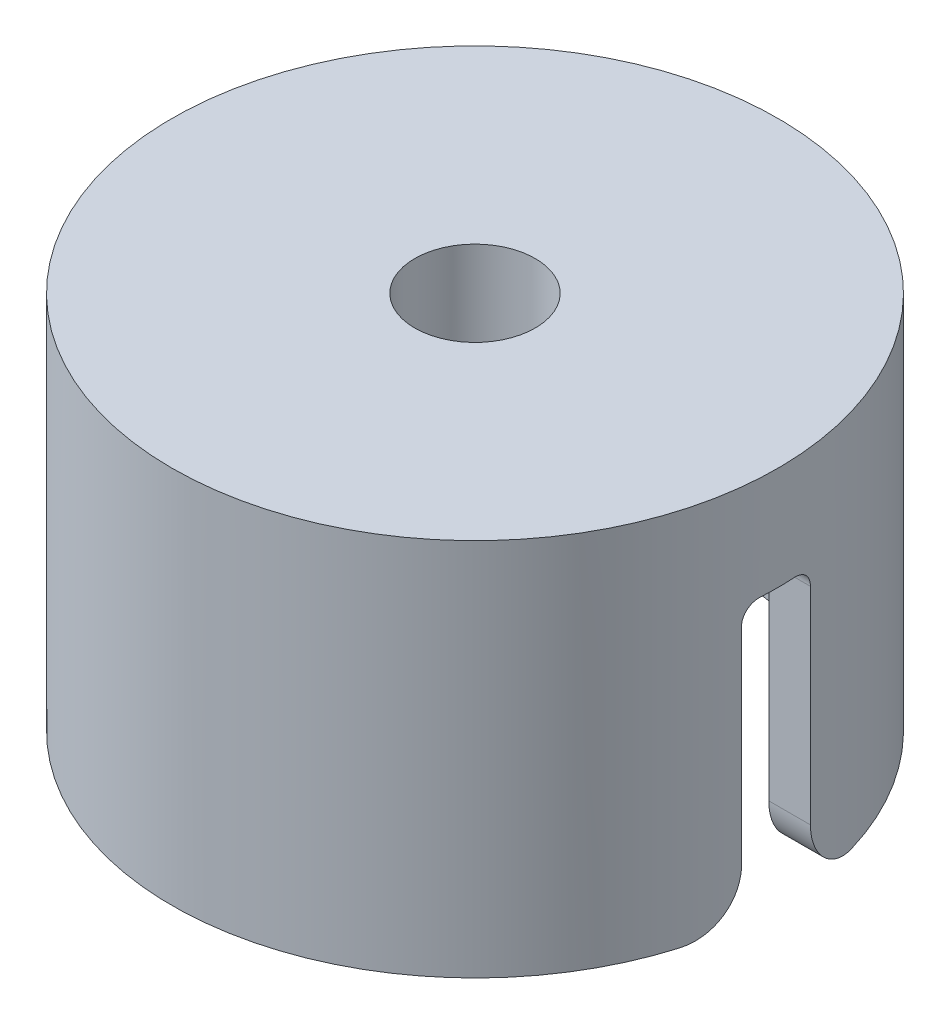
from build123d import *

# Parameters (mm, degrees)
SKETCH1_R                = 8.8
SKETCH1_R_2              = 7.6
BOSS_EXTRUDE1_DEPTH      = 10
SKETCH2_W                = 18.171732103
SKETCH2_H                = 2
CUT_EXTRUDE1_DEPTH       = 8
SKETCH3_R                = 8.8
BOSS_EXTRUDE2_DEPTH      = 1
SKETCH4_R                = 1.75
CUT_EXTRUDE2_DEPTH       = 17.609635758
FILLET1_R                = 0.5
FILLET3_R                = 1.5
CIRPATTERN1_COUNT        = 2
FILLET1_OF_CIRPATTERN1_R = 0.5
FILLET3_OF_CIRPATTERN1_R = 1.5
SKETCH5_R                = 2.95
SKETCH5_R_2              = 1.75
BOSS_EXTRUDE3_DEPTH      = 3
FILLET6_R                = 1


with BuildPart() as part:
    # Sketch1 → Boss-Extrude1 (new body)
    with BuildSketch(Plane(origin=(0, 0, 0), x_dir=(1, 0, 0), z_dir=(0, 1, 0))):
        with Locations(Location((0, 0, 0), (0, 0, 270))):
            Circle(SKETCH1_R)
        with Locations(Location((0, 0, 0), (0, 0, 270))):
            Circle(SKETCH1_R_2, mode=Mode.SUBTRACT)
    extrude(amount=BOSS_EXTRUDE1_DEPTH)

    # Sketch2 → Cut-Extrude1 (cut)
    with BuildSketch(Plane.XZ):
        with Locations((9.085866052, 0)):
            Rectangle(SKETCH2_W, SKETCH2_H)
    cut_extrude1 = extrude(amount=-CUT_EXTRUDE1_DEPTH, mode=Mode.SUBTRACT)

    # Sketch3 → Boss-Extrude2 (add)
    with BuildSketch(Plane(origin=(0, 10, 0), x_dir=(1, 0, 0), z_dir=(0, 1, 0))):
        with Locations(Location((0, 0, 0), (0, 0, 6.524978844))):
            Circle(SKETCH3_R)
    extrude(amount=BOSS_EXTRUDE2_DEPTH)

    # Sketch4 → Cut-Extrude2 (cut, through all)
    with BuildSketch(Plane(origin=(0, 11, 0), x_dir=(1, 0, 0), z_dir=(0, 1, 0))):
        with Locations(Location((0, 0, 0), (0, 0, 270))):
            Circle(SKETCH4_R)
    extrude(amount=-CUT_EXTRUDE2_DEPTH, mode=Mode.SUBTRACT)

    # Fillet1
    fillet1_edges = [part.edges().sort_by_distance(p)[0] for p in [
        (8.138460239, 8, -1),
        (8.138460239, 8, 1),
    ]]
    fillet(fillet1_edges, radius=FILLET1_R)

    # Fillet3
    fillet3_edges = [part.edges().sort_by_distance(p)[0] for p in [
        (8.138460239, 0, 1),
        (8.138460239, 0, -1),
    ]]
    fillet(fillet3_edges, radius=FILLET3_R)

    # CirPattern1: Cut-Extrude1 ×2 about axis
    cirpattern1_axis = Axis((0, 0, 0), (0, -1, 0))
    for i in range(1, CIRPATTERN1_COUNT):
        add(cut_extrude1.rotate(cirpattern1_axis, i * 360 / CIRPATTERN1_COUNT), mode=Mode.SUBTRACT)

    # Fillet1 of CirPattern1
    fillet1_of_cirpattern1_edges = [part.edges().sort_by_distance(p)[0] for p in [
        (-8.138460239, 8, 1),
        (-8.138460239, 8, -1),
    ]]
    fillet(fillet1_of_cirpattern1_edges, radius=FILLET1_OF_CIRPATTERN1_R)

    # Fillet3 of CirPattern1
    fillet3_of_cirpattern1_edges = [part.edges().sort_by_distance(p)[0] for p in [
        (-8.138460239, 0, -1),
        (-8.138460239, 0, 1),
    ]]
    fillet(fillet3_of_cirpattern1_edges, radius=FILLET3_OF_CIRPATTERN1_R)

    # Sketch5 → Boss-Extrude3 (add)
    with BuildSketch(Plane.XZ.offset(-10)):
        with Locations(Location((0, 0, 0), (0, 0, 90))):
            Circle(SKETCH5_R)
        with Locations(Location((0, 0, 0), (0, 0, 90))):
            Circle(SKETCH5_R_2, mode=Mode.SUBTRACT)
    extrude(amount=BOSS_EXTRUDE3_DEPTH)

    # Fillet6
    fillet6_edges = [part.edges().sort_by_distance(p)[0] for p in [
        (0, 10, -7.6),
    ]]
    fillet(fillet6_edges, radius=FILLET6_R)


solid = part.part
